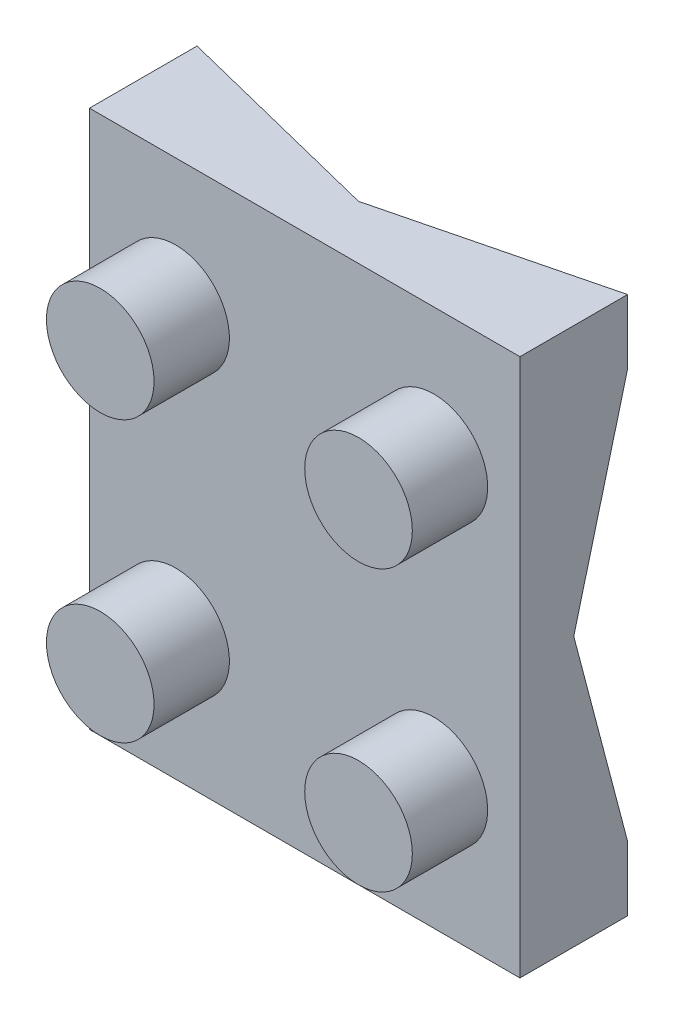
from build123d import *

# Parameters (mm, degrees)
SKETCH1_W           = 20
SKETCH1_H           = 25
BOSS_EXTRUDE1_DEPTH = 5
SKETCH2_R           = 2.5
BOSS_EXTRUDE2_DEPTH = 3.5
CUT_EXTRUDE1_DEPTH  = 23.5
CUT_EXTRUDE2_DEPTH  = 33.5


with BuildPart() as part:
    # Sketch1 → Boss-Extrude1 (new body)
    with BuildSketch(Plane.XY):
        with Locations((10, 12.5)):
            Rectangle(SKETCH1_W, SKETCH1_H)
    extrude(amount=BOSS_EXTRUDE1_DEPTH)

    # Sketch2 → Boss-Extrude2 (add)
    with BuildSketch(Plane.XY.offset(5)):
        with Locations(Location((4, 19, 0), (0, 0, 180))):
            Circle(SKETCH2_R)
        with Locations(Location((16, 19, 0), (0, 0, 180))):
            Circle(SKETCH2_R)
        with Locations(Location((16, 6, 0), (0, 0, 180))):
            Circle(SKETCH2_R)
        with Locations(Location((4, 6, 0), (0, 0, 180))):
            Circle(SKETCH2_R)
    extrude(amount=BOSS_EXTRUDE2_DEPTH)

    # Sketch3 → Cut-Extrude1 (cut)
    with BuildSketch(Plane(origin=(20, 0, 0), x_dir=(0, 0, -1), z_dir=(1, 0, 0))):
        Polygon((0, 22), (-2.5, 12.5), (0, 12.5), align=None)
        Polygon((0, 12.5), (-2.5, 12.5), (0, 3), align=None)
    extrude(amount=-CUT_EXTRUDE1_DEPTH, mode=Mode.SUBTRACT)

    # Sketch4 → Cut-Extrude2 (cut)
    with BuildSketch(Plane(origin=(0, 0, 0), x_dir=(-1, 0, 0), z_dir=(0, -1, 0))):
        Polygon((0, 0), (-10, -2.5), (-20, 0), align=None)
    extrude(amount=-CUT_EXTRUDE2_DEPTH, mode=Mode.SUBTRACT)


solid = part.part
